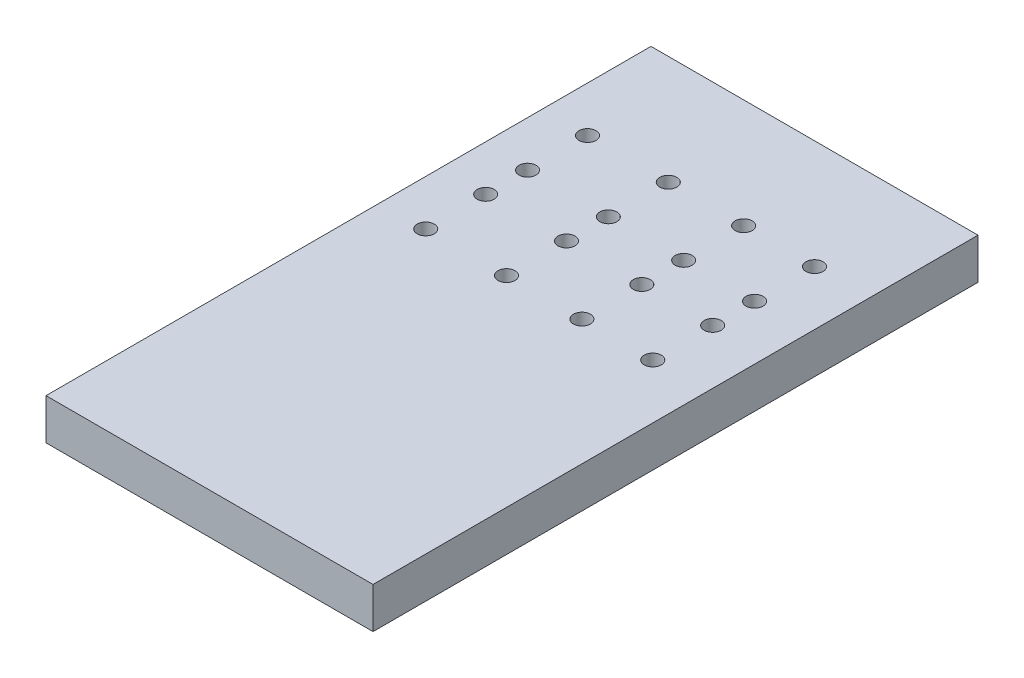
from build123d import *

# Parameters (mm, degrees)
SKETCH1_W           = 76.2
SKETCH1_H           = 140.97
SKETCH1_R           = 1.984375
BOSS_EXTRUDE1_DEPTH = 9.525


with BuildPart() as part:
    # Sketch1 → Boss-Extrude1 (new body)
    with BuildSketch(Plane(origin=(0, 0, 0), x_dir=(1, 0, 0), z_dir=(0, 1, 0))):
        Rectangle(SKETCH1_W, SKETCH1_H)
        with Locations(Location((-27.49804, 45.085, 0), (0, 0, 90))):
            Circle(SKETCH1_R, mode=Mode.SUBTRACT)
        with Locations(Location((-27.49804, 21.36447634, 0), (0, 0, 90))):
            Circle(SKETCH1_R, mode=Mode.SUBTRACT)
        with Locations(Location((-27.49804, 31.115, 0), (0, 0, 90))):
            Circle(SKETCH1_R, mode=Mode.SUBTRACT)
        with Locations(Location((-8.67029, 45.085, 0), (0, 0, 90))):
            Circle(SKETCH1_R, mode=Mode.SUBTRACT)
        with Locations(Location((8.89, 45.085, 0), (0, 0, 90))):
            Circle(SKETCH1_R, mode=Mode.SUBTRACT)
        with Locations(Location((25.4, 45.085, 0), (0, 0, 90))):
            Circle(SKETCH1_R, mode=Mode.SUBTRACT)
        with Locations(Location((25.4, 7.39447634, 0), (0, 0, 90))):
            Circle(SKETCH1_R, mode=Mode.SUBTRACT)
        with Locations(Location((25.4, 31.115, 0), (0, 0, 90))):
            Circle(SKETCH1_R, mode=Mode.SUBTRACT)
        with Locations(Location((8.89, 31.115, 0), (0, 0, 90))):
            Circle(SKETCH1_R, mode=Mode.SUBTRACT)
        with Locations(Location((-8.67029, 21.36447634, 0), (0, 0, 90))):
            Circle(SKETCH1_R, mode=Mode.SUBTRACT)
        with Locations(Location((8.89, 21.36447634, 0), (0, 0, 90))):
            Circle(SKETCH1_R, mode=Mode.SUBTRACT)
        with Locations(Location((25.4, 21.36447634, 0), (0, 0, 90))):
            Circle(SKETCH1_R, mode=Mode.SUBTRACT)
        with Locations(Location((8.89, 7.39447634, 0), (0, 0, 90))):
            Circle(SKETCH1_R, mode=Mode.SUBTRACT)
        with Locations(Location((-8.67029, 7.39447634, 0), (0, 0, 90))):
            Circle(SKETCH1_R, mode=Mode.SUBTRACT)
        with Locations(Location((-27.49804, 7.39447634, 0), (0, 0, 90))):
            Circle(SKETCH1_R, mode=Mode.SUBTRACT)
        with Locations(Location((-8.67029, 31.115, 0), (0, 0, 90))):
            Circle(SKETCH1_R, mode=Mode.SUBTRACT)
    extrude(amount=BOSS_EXTRUDE1_DEPTH)


solid = part.part
